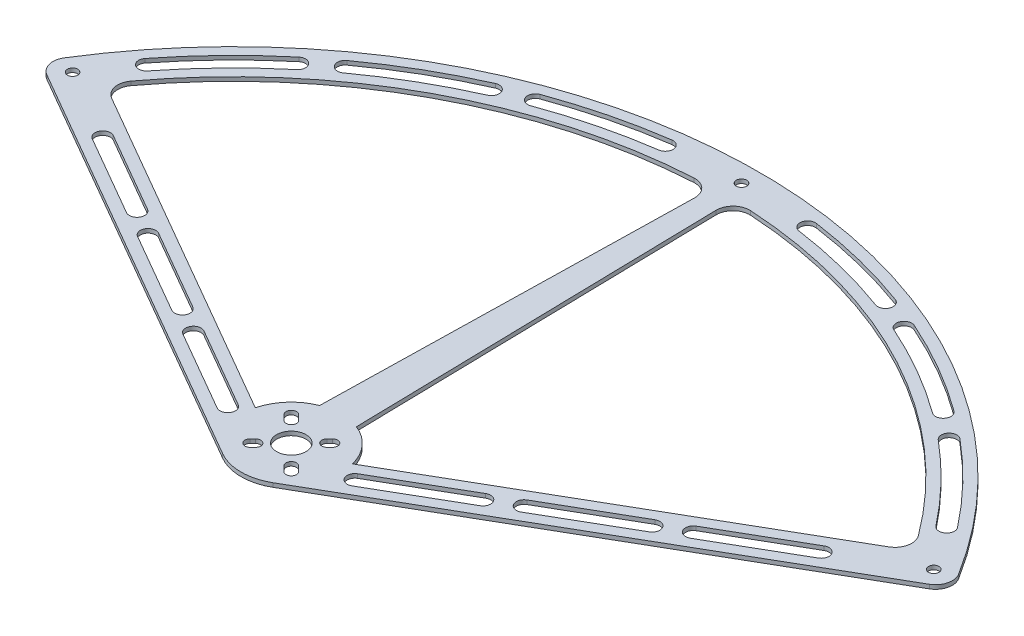
from build123d import *

# Parameters (mm, degrees)
SKETCH_1_R      = 1.55
SKETCH_1_R_2    = 4.4
EXTRUDE_1_DEPTH = 1.2
FILLET_1_R      = 5


with BuildPart() as part:
    # 草图1 → 凸台-拉伸1 (new body)
    with BuildSketch(Plane(origin=(0, 0, 0), x_dir=(1, 0, 0), z_dir=(0, 1, 0))):
        with BuildLine():
            ThreePointArc((-7.5, 4.330127019), (0, 2.320508076), (7.5, 4.330127019))
            Line((7.5, 4.330127019), (131.842341019, 76.119211078))
            ThreePointArc((131.842341019, 76.119211078), (134.192561968, 79.234695458), (133.588070719, 83.090129515))
            ThreePointArc((133.588070719, 83.090129515), (0, 157.320508076), (-133.588070719, 83.090129515))
            ThreePointArc((-133.588070719, 83.090129515), (-134.192561968, 79.234695458), (-131.842341019, 76.119211078))
            Line((-131.842341019, 76.119211078), (-7.5, 4.330127019))
        make_face()
        with BuildLine():
            Line((-7.247844507, 12.26469459), (-6.434671709, 13.077867389))
            ThreePointArc((-6.434671709, 13.077867389), (-4.242640687, 13.077867389), (-4.242640687, 10.885836367))
            Line((-4.242640687, 10.885836367), (-5.055813485, 10.072663569))
            ThreePointArc((-5.055813485, 10.072663569), (-7.247844507, 10.072663569), (-7.247844507, 12.26469459))
        make_face(mode=Mode.SUBTRACT)
        with BuildLine():
            ThreePointArc((-44.398711306, 29.328649647), (-45.240569735, 32.470508076), (-42.098711306, 33.312366504))
            Line((-42.098711306, 33.312366504), (-17.85, 19.312366504))
            ThreePointArc((-17.85, 19.312366504), (-17.008141571, 16.170508076), (-20.15, 15.328649647))
            Line((-20.15, 15.328649647), (-44.398711306, 29.328649647))
        make_face(mode=Mode.SUBTRACT)
        with BuildLine():
            ThreePointArc((-8.485281374, 23.613758428), (-8.485281374, 25.80578945), (-6.293250353, 25.80578945))
            Line((-6.293250353, 25.80578945), (-4.772970773, 24.28550987))
            ThreePointArc((-4.772970773, 24.28550987), (-4.772970773, 22.093478849), (-6.965001795, 22.093478849))
            Line((-6.965001795, 22.093478849), (-8.485281374, 23.613758428))
        make_face(mode=Mode.SUBTRACT)
        with BuildLine():
            ThreePointArc((-76.441651246, 47.828649647), (-77.283509675, 50.970508076), (-74.141651246, 51.812366504))
            Line((-74.141651246, 51.812366504), (-49.89293994, 37.812366504))
            ThreePointArc((-49.89293994, 37.812366504), (-49.051081511, 34.670508076), (-52.19293994, 33.828649647))
            Line((-52.19293994, 33.828649647), (-76.441651246, 47.828649647))
        make_face(mode=Mode.SUBTRACT)
        with BuildLine():
            ThreePointArc((-108.484591186, 66.328649647), (-109.326449615, 69.470508076), (-106.184591186, 70.312366504))
            Line((-106.184591186, 70.312366504), (-81.93587988, 56.312366504))
            ThreePointArc((-81.93587988, 56.312366504), (-81.094021451, 53.170508076), (-84.23587988, 52.328649647))
            Line((-84.23587988, 52.328649647), (-108.484591186, 66.328649647))
        make_face(mode=Mode.SUBTRACT)
        with Locations(Location((-128.644111376, 80.623565294, 0), (0, 0, 270))):
            Circle(SKETCH_1_R, mode=Mode.SUBTRACT)
        with BuildLine():
            Line((6.965001795, 12.547537303), (8.485281374, 11.027257723))
            ThreePointArc((8.485281374, 11.027257723), (8.485281374, 8.835226701), (6.293250353, 8.835226701))
            Line((6.293250353, 8.835226701), (4.772970773, 10.355506281))
            ThreePointArc((4.772970773, 10.355506281), (4.772970773, 12.547537303), (6.965001795, 12.547537303))
        make_face(mode=Mode.SUBTRACT)
        with Locations(Location((0, 17.320508076, 0), (0, 0, 270))):
            Circle(SKETCH_1_R_2, mode=Mode.SUBTRACT)
        with BuildLine():
            ThreePointArc((6.434671709, 21.563148763), (4.242640687, 21.563148763), (4.242640687, 23.755179784))
            Line((4.242640687, 23.755179784), (5.055813485, 24.568352583))
            ThreePointArc((5.055813485, 24.568352583), (7.247844507, 24.568352583), (7.247844507, 22.376321561))
            Line((7.247844507, 22.376321561), (6.434671709, 21.563148763))
        make_face(mode=Mode.SUBTRACT)
        with BuildLine():
            Line((17.85, 19.312366504), (42.098711306, 33.312366504))
            ThreePointArc((42.098711306, 33.312366504), (45.240569735, 32.470508076), (44.398711306, 29.328649647))
            Line((44.398711306, 29.328649647), (20.15, 15.328649647))
            ThreePointArc((20.15, 15.328649647), (17.008141571, 16.170508076), (17.85, 19.312366504))
        make_face(mode=Mode.SUBTRACT)
        with BuildLine():
            Line((49.89293994, 37.812366504), (74.141651246, 51.812366504))
            ThreePointArc((74.141651246, 51.812366504), (77.283509675, 50.970508076), (76.441651246, 47.828649647))
            Line((76.441651246, 47.828649647), (52.19293994, 33.828649647))
            ThreePointArc((52.19293994, 33.828649647), (49.051081511, 34.670508076), (49.89293994, 37.812366504))
        make_face(mode=Mode.SUBTRACT)
        with BuildLine():
            Line((81.93587988, 56.312366504), (106.184591186, 70.312366504))
            ThreePointArc((106.184591186, 70.312366504), (109.326449615, 69.470508076), (108.484591186, 66.328649647))
            Line((108.484591186, 66.328649647), (84.23587988, 52.328649647))
            ThreePointArc((84.23587988, 52.328649647), (81.094021451, 53.170508076), (81.93587988, 56.312366504))
        make_face(mode=Mode.SUBTRACT)
        with Locations(Location((128.644111376, 80.623565294, 0), (0, 0, 270))):
            Circle(SKETCH_1_R, mode=Mode.SUBTRACT)
        with BuildLine():
            ThreePointArc((-121.36730718, 94.990040307), (-110.680666398, 107.251671759), (-98.761313169, 118.318781395))
            ThreePointArc((-98.761313169, 118.318781395), (-95.521742889, 118.026917726), (-95.813606558, 114.787347446))
            ThreePointArc((-95.813606558, 114.787347446), (-107.377205543, 104.050555333), (-117.74488457, 92.154894025))
            ThreePointArc((-117.74488457, 92.154894025), (-120.973669016, 91.761255861), (-121.36730718, 94.990040307))
        make_face(mode=Mode.SUBTRACT)
        with BuildLine():
            ThreePointArc((-90.69744613, 124.607801823), (-77.060254038, 133.472275238), (-62.564798823, 140.850193318))
            ThreePointArc((-62.564798823, 140.850193318), (-59.529158156, 139.681910073), (-60.697441401, 136.646269406))
            ThreePointArc((-60.697441401, 136.646269406), (-74.760254038, 129.48855838), (-87.990419937, 120.888660901))
            ThreePointArc((-87.990419937, 120.888660901), (-91.203503494, 121.394718266), (-90.69744613, 124.607801823))
        make_face(mode=Mode.SUBTRACT)
        with BuildLine():
            ThreePointArc((-53.086413848, 144.689196813), (-37.542339143, 149.478104688), (-21.580134422, 152.60219136))
            ThreePointArc((-21.580134422, 152.60219136), (-18.980744151, 150.646898487), (-20.936037023, 148.047508216))
            ThreePointArc((-20.936037023, 148.047508216), (-36.421821425, 145.016665454), (-51.501955642, 140.37069103))
            ThreePointArc((-51.501955642, 140.37069103), (-54.453437636, 141.737714818), (-53.086413848, 144.689196813))
        make_face(mode=Mode.SUBTRACT)
        with BuildLine():
            Line((-14.519984026, 21.084822608), (-116.100224104, 79.732201561))
            ThreePointArc((-116.100224104, 79.732201561), (-118.495458951, 83.044155809), (-117.619464681, 87.036501605))
            ThreePointArc((-117.619464681, 87.036501605), (-67.234108176, 129.958707986), (-3.090840664, 146.287859331))
            Line((-3.090840664, 146.287859331), (-5.5, 31.275793813))
            ThreePointArc((-5.5, 31.275793813), (-11.23227108, 27.262142065), (-14.519984026, 21.084822608))
        make_face(mode=Mode.SUBTRACT)
        with BuildLine():
            ThreePointArc((14.519984026, 21.084822608), (11.23227108, 27.262142065), (5.5, 31.275793813))
            Line((5.5, 31.275793813), (3.090840664, 146.287859331))
            ThreePointArc((3.090840664, 146.287859331), (67.234108176, 129.958707986), (117.619464681, 87.036501605))
            ThreePointArc((117.619464681, 87.036501605), (118.495458951, 83.044155809), (116.100224104, 79.732201561))
            Line((116.100224104, 79.732201561), (14.519984026, 21.084822608))
        make_face(mode=Mode.SUBTRACT)
        with BuildLine():
            ThreePointArc((95.813606558, 114.787347446), (95.521742889, 118.026917726), (98.761313169, 118.318781395))
            ThreePointArc((98.761313169, 118.318781395), (110.680666398, 107.251671759), (121.36730718, 94.990040307))
            ThreePointArc((121.36730718, 94.990040307), (120.973669016, 91.761255861), (117.74488457, 92.154894025))
            ThreePointArc((117.74488457, 92.154894025), (107.377205543, 104.050555333), (95.813606558, 114.787347446))
        make_face(mode=Mode.SUBTRACT)
        with Locations(Location((0, 151.820508076, 0), (0, 0, 270))):
            Circle(SKETCH_1_R, mode=Mode.SUBTRACT)
        with BuildLine():
            ThreePointArc((20.936037023, 148.047508216), (18.980744151, 150.646898487), (21.580134422, 152.60219136))
            ThreePointArc((21.580134422, 152.60219136), (37.542339143, 149.478104688), (53.086413848, 144.689196813))
            ThreePointArc((53.086413848, 144.689196813), (54.453437636, 141.737714818), (51.501955642, 140.37069103))
            ThreePointArc((51.501955642, 140.37069103), (36.421821425, 145.016665454), (20.936037023, 148.047508216))
        make_face(mode=Mode.SUBTRACT)
        with BuildLine():
            ThreePointArc((87.990419937, 120.888660901), (74.760254038, 129.48855838), (60.697441401, 136.646269406))
            ThreePointArc((60.697441401, 136.646269406), (59.529158156, 139.681910073), (62.564798823, 140.850193318))
            ThreePointArc((62.564798823, 140.850193318), (77.060254038, 133.472275238), (90.69744613, 124.607801823))
            ThreePointArc((90.69744613, 124.607801823), (91.203503494, 121.394718266), (87.990419937, 120.888660901))
        make_face(mode=Mode.SUBTRACT)
    extrude(amount=EXTRUDE_1_DEPTH)

    # 圆角1
    fillet_1_edges = [part.edges().sort_by_distance(p)[0] for p in [
        (3.090840664, 0.6, -146.287859331),
        (-3.090840664, 0.6, -146.287859331),
    ]]
    fillet(fillet_1_edges, radius=FILLET_1_R)


solid = part.part
